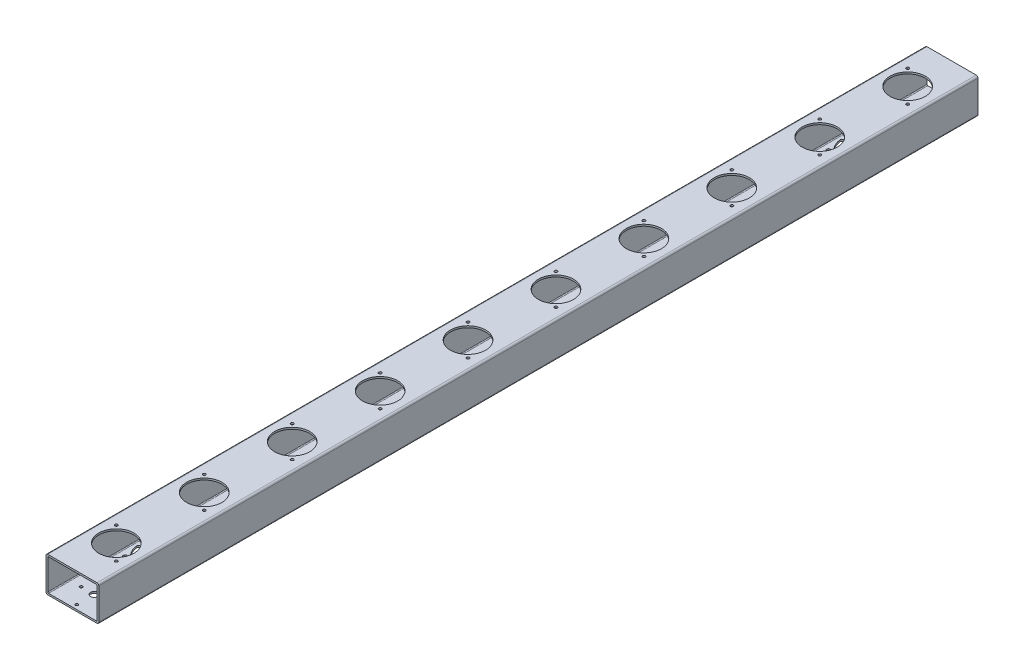
from build123d import *

# Parameters (mm, degrees)
ESQUISSE1_W                      = 60
ESQUISSE1_H                      = 40
ESQUISSE1_W_2                    = 56
ESQUISSE1_H_2                    = 36
BOSS_EXTRU_1_DEPTH               = 1000
CONG_1_R                         = 1
CONG_2_R                         = 2
ENL_V_MAT_EXTRU_1_REACH          = 1004.597
ESQUISSE2_R                      = 20
ENL_V_MAT_EXTRU_2_REACH          = 1004.597
ESQUISSE3_R                      = 4.25
ENL_V_MAT_EXTRU_3_REACH          = 1004.597
ESQUISSE4_R                      = 1.6
ENL_V_MAT_EXTRU_4_REACH          = 1004.597
ESQUISSE6_R                      = 1.6
R_P_TITION_LIN_AIRE1_COUNT       = 3
R_P_TITION_LIN_AIRE1_PITCH       = 200
R_P_TITION_LIN_AIRE1_COL_COUNT   = 2
R_P_TITION_LIN_AIRE1_COL_PITCH   = 200
ENL_V_MAT_EXTRU_5_REACH          = 1004.597
ESQUISSE7_R                      = 1.6
R_P_TITION_LIN_AIRE2_COUNT       = 10
R_P_TITION_LIN_AIRE2_PITCH       = 100
ENL_V_MAT_EXTRU_6_REACH          = 1004.597
ESQUISSE9_R                      = 1.1
R_P_TITION_LIN_AIRE3_COUNT       = 10
R_P_TITION_LIN_AIRE3_PITCH       = 100
ENL_V_MAT_EXTRU_7_REACH          = 1004.597
ESQUISSE10_R                     = 2.1
R_P_TITION_LIN_AIRE4_COUNT       = 2
R_P_TITION_LIN_AIRE4_PITCH       = 800
ENL_V_MAT_EXTRU_8_REACH          = 1004.597
CONG_3_R                         = 2
R_P_TITION_LIN_AIRE5_COUNT       = 2
R_P_TITION_LIN_AIRE5_PITCH       = 800
CONG_3_OF_R_P_TITION_LIN_AIRE5_R = 2
ENL_V_MAT_EXTRU_9_REACH          = 1004.597
ESQUISSE12_R                     = 1.6
ENL_V_MAT_EXTRU_10_REACH         = 1004.597
ESQUISSE13_R                     = 1.9
ESQUISSE13_W                     = 26
ESQUISSE13_H                     = 14
ENL_V_MAT_EXTRU_11_REACH         = 1004.597
ESQUISSE14_R                     = 1.6
ENL_V_MAT_EXTRU_12_REACH         = 1004.597
ESQUISSE15_R                     = 2.5


with BuildPart() as part:
    # Esquisse1 → Boss.-Extru.1 (new body)
    with BuildSketch(Plane.XY):
        with Locations((30, 20)):
            Rectangle(ESQUISSE1_W, ESQUISSE1_H)
        with Locations((30, 20)):
            Rectangle(ESQUISSE1_W_2, ESQUISSE1_H_2, mode=Mode.SUBTRACT)
    extrude(amount=BOSS_EXTRU_1_DEPTH)

    # Congé1
    cong_1_edges = [part.edges().sort_by_distance(p)[0] for p in [
        (2, 38, 500),
        (2, 2, 500),
        (58, 2, 500),
        (58, 38, 500),
    ]]
    fillet(cong_1_edges, radius=CONG_1_R)

    # Congé2
    cong_2_edges = [part.edges().sort_by_distance(p)[0] for p in [
        (0, 40, 500),
        (60, 40, 500),
        (60, 0, 500),
        (0, 0, 500),
    ]]
    fillet(cong_2_edges, radius=CONG_2_R)

    # Esquisse2 → Enlèv. mat.-Extru.1 (cut, up to next)
    with BuildSketch(Plane(origin=(0, 40, 0), x_dir=(1, 0, 0), z_dir=(0, 1, 0)), mode=Mode.PRIVATE) as enl_v_mat_extru_1_sk1:
        with Locations(Location((30, -50, 0), (0, 0, 270))):
            Circle(ESQUISSE2_R)
    enl_v_mat_extru_1_tool1 = extrude(enl_v_mat_extru_1_sk1.sketch, amount=-ENL_V_MAT_EXTRU_1_REACH, mode=Mode.PRIVATE) & part.part
    # Esquisse2 → Enlèv. mat.-Extru.1 (cut, up to next)
    with BuildSketch(Plane(origin=(0, 40, 0), x_dir=(1, 0, 0), z_dir=(0, 1, 0)), mode=Mode.PRIVATE) as enl_v_mat_extru_1_sk2:
        with Locations(Location((30, -150, 0), (0, 0, 270))):
            Circle(ESQUISSE2_R)
    enl_v_mat_extru_1_tool2 = extrude(enl_v_mat_extru_1_sk2.sketch, amount=-ENL_V_MAT_EXTRU_1_REACH, mode=Mode.PRIVATE) & part.part
    # Esquisse2 → Enlèv. mat.-Extru.1 (cut, up to next)
    with BuildSketch(Plane(origin=(0, 40, 0), x_dir=(1, 0, 0), z_dir=(0, 1, 0)), mode=Mode.PRIVATE) as enl_v_mat_extru_1_sk3:
        with Locations(Location((30, -250, 0), (0, 0, 270))):
            Circle(ESQUISSE2_R)
    enl_v_mat_extru_1_tool3 = extrude(enl_v_mat_extru_1_sk3.sketch, amount=-ENL_V_MAT_EXTRU_1_REACH, mode=Mode.PRIVATE) & part.part
    # Esquisse2 → Enlèv. mat.-Extru.1 (cut, up to next)
    with BuildSketch(Plane(origin=(0, 40, 0), x_dir=(1, 0, 0), z_dir=(0, 1, 0)), mode=Mode.PRIVATE) as enl_v_mat_extru_1_sk4:
        with Locations(Location((30, -350, 0), (0, 0, 270))):
            Circle(ESQUISSE2_R)
    enl_v_mat_extru_1_tool4 = extrude(enl_v_mat_extru_1_sk4.sketch, amount=-ENL_V_MAT_EXTRU_1_REACH, mode=Mode.PRIVATE) & part.part
    # Esquisse2 → Enlèv. mat.-Extru.1 (cut, up to next)
    with BuildSketch(Plane(origin=(0, 40, 0), x_dir=(1, 0, 0), z_dir=(0, 1, 0)), mode=Mode.PRIVATE) as enl_v_mat_extru_1_sk5:
        with Locations(Location((30, -450, 0), (0, 0, 270))):
            Circle(ESQUISSE2_R)
    enl_v_mat_extru_1_tool5 = extrude(enl_v_mat_extru_1_sk5.sketch, amount=-ENL_V_MAT_EXTRU_1_REACH, mode=Mode.PRIVATE) & part.part
    # Esquisse2 → Enlèv. mat.-Extru.1 (cut, up to next)
    with BuildSketch(Plane(origin=(0, 40, 0), x_dir=(1, 0, 0), z_dir=(0, 1, 0)), mode=Mode.PRIVATE) as enl_v_mat_extru_1_sk6:
        with Locations(Location((30, -550, 0), (0, 0, 270))):
            Circle(ESQUISSE2_R)
    enl_v_mat_extru_1_tool6 = extrude(enl_v_mat_extru_1_sk6.sketch, amount=-ENL_V_MAT_EXTRU_1_REACH, mode=Mode.PRIVATE) & part.part
    # Esquisse2 → Enlèv. mat.-Extru.1 (cut, up to next)
    with BuildSketch(Plane(origin=(0, 40, 0), x_dir=(1, 0, 0), z_dir=(0, 1, 0)), mode=Mode.PRIVATE) as enl_v_mat_extru_1_sk7:
        with Locations(Location((30, -650, 0), (0, 0, 270))):
            Circle(ESQUISSE2_R)
    enl_v_mat_extru_1_tool7 = extrude(enl_v_mat_extru_1_sk7.sketch, amount=-ENL_V_MAT_EXTRU_1_REACH, mode=Mode.PRIVATE) & part.part
    # Esquisse2 → Enlèv. mat.-Extru.1 (cut, up to next)
    with BuildSketch(Plane(origin=(0, 40, 0), x_dir=(1, 0, 0), z_dir=(0, 1, 0)), mode=Mode.PRIVATE) as enl_v_mat_extru_1_sk8:
        with Locations(Location((30, -750, 0), (0, 0, 270))):
            Circle(ESQUISSE2_R)
    enl_v_mat_extru_1_tool8 = extrude(enl_v_mat_extru_1_sk8.sketch, amount=-ENL_V_MAT_EXTRU_1_REACH, mode=Mode.PRIVATE) & part.part
    # Esquisse2 → Enlèv. mat.-Extru.1 (cut, up to next)
    with BuildSketch(Plane(origin=(0, 40, 0), x_dir=(1, 0, 0), z_dir=(0, 1, 0)), mode=Mode.PRIVATE) as enl_v_mat_extru_1_sk9:
        with Locations(Location((30, -850, 0), (0, 0, 270))):
            Circle(ESQUISSE2_R)
    enl_v_mat_extru_1_tool9 = extrude(enl_v_mat_extru_1_sk9.sketch, amount=-ENL_V_MAT_EXTRU_1_REACH, mode=Mode.PRIVATE) & part.part
    # Esquisse2 → Enlèv. mat.-Extru.1 (cut, up to next)
    with BuildSketch(Plane(origin=(0, 40, 0), x_dir=(1, 0, 0), z_dir=(0, 1, 0)), mode=Mode.PRIVATE) as enl_v_mat_extru_1_sk10:
        with Locations(Location((30, -950, 0), (0, 0, 270))):
            Circle(ESQUISSE2_R)
    enl_v_mat_extru_1_tool10 = extrude(enl_v_mat_extru_1_sk10.sketch, amount=-ENL_V_MAT_EXTRU_1_REACH, mode=Mode.PRIVATE) & part.part
    add(enl_v_mat_extru_1_tool1.solids().sort_by_distance((30, 40, 50))[0], mode=Mode.SUBTRACT)
    add(enl_v_mat_extru_1_tool2.solids().sort_by_distance((30, 40, 150))[0], mode=Mode.SUBTRACT)
    add(enl_v_mat_extru_1_tool3.solids().sort_by_distance((30, 40, 250))[0], mode=Mode.SUBTRACT)
    add(enl_v_mat_extru_1_tool4.solids().sort_by_distance((30, 40, 350))[0], mode=Mode.SUBTRACT)
    add(enl_v_mat_extru_1_tool5.solids().sort_by_distance((30, 40, 450))[0], mode=Mode.SUBTRACT)
    add(enl_v_mat_extru_1_tool6.solids().sort_by_distance((30, 40, 550))[0], mode=Mode.SUBTRACT)
    add(enl_v_mat_extru_1_tool7.solids().sort_by_distance((30, 40, 650))[0], mode=Mode.SUBTRACT)
    add(enl_v_mat_extru_1_tool8.solids().sort_by_distance((30, 40, 750))[0], mode=Mode.SUBTRACT)
    add(enl_v_mat_extru_1_tool9.solids().sort_by_distance((30, 40, 850))[0], mode=Mode.SUBTRACT)
    add(enl_v_mat_extru_1_tool10.solids().sort_by_distance((30, 40, 950))[0], mode=Mode.SUBTRACT)

    # Esquisse3 → Enlèv. mat.-Extru.2 (cut, up to next)
    with BuildSketch(Plane.XZ, mode=Mode.PRIVATE) as enl_v_mat_extru_2_sk1:
        with Locations(Location((30, 975, 0), (0, 0, 270))):
            Circle(ESQUISSE3_R)
    enl_v_mat_extru_2_tool1 = extrude(enl_v_mat_extru_2_sk1.sketch, amount=-ENL_V_MAT_EXTRU_2_REACH, mode=Mode.PRIVATE) & part.part
    # Esquisse3 → Enlèv. mat.-Extru.2 (cut, up to next)
    with BuildSketch(Plane.XZ, mode=Mode.PRIVATE) as enl_v_mat_extru_2_sk2:
        with Locations(Location((30, 25, 0), (0, 0, 270))):
            Circle(ESQUISSE3_R)
    enl_v_mat_extru_2_tool2 = extrude(enl_v_mat_extru_2_sk2.sketch, amount=-ENL_V_MAT_EXTRU_2_REACH, mode=Mode.PRIVATE) & part.part
    # Esquisse3 → Enlèv. mat.-Extru.2 (cut, up to next)
    with BuildSketch(Plane.XZ, mode=Mode.PRIVATE) as enl_v_mat_extru_2_sk3:
        with Locations(Location((30, 500, 0), (0, 0, 270))):
            Circle(ESQUISSE3_R)
    enl_v_mat_extru_2_tool3 = extrude(enl_v_mat_extru_2_sk3.sketch, amount=-ENL_V_MAT_EXTRU_2_REACH, mode=Mode.PRIVATE) & part.part
    add(enl_v_mat_extru_2_tool1.solids().sort_by_distance((30, 0, 975))[0], mode=Mode.SUBTRACT)
    add(enl_v_mat_extru_2_tool2.solids().sort_by_distance((30, 0, 25))[0], mode=Mode.SUBTRACT)
    add(enl_v_mat_extru_2_tool3.solids().sort_by_distance((30, 0, 500))[0], mode=Mode.SUBTRACT)

    # Esquisse4 → Enlèv. mat.-Extru.3 (cut, up to next)
    with BuildSketch(Plane(origin=(0, 40, 0), x_dir=(1, 0, 0), z_dir=(0, 1, 0)), mode=Mode.PRIVATE) as enl_v_mat_extru_3_sk1:
        with Locations(Location((12.32233047, -32.32233047, 0), (0, 0, 270))):
            Circle(ESQUISSE4_R)
    enl_v_mat_extru_3_tool1 = extrude(enl_v_mat_extru_3_sk1.sketch, amount=-ENL_V_MAT_EXTRU_3_REACH, mode=Mode.PRIVATE) & part.part
    # Esquisse4 → Enlèv. mat.-Extru.3 (cut, up to next)
    with BuildSketch(Plane(origin=(0, 40, 0), x_dir=(1, 0, 0), z_dir=(0, 1, 0)), mode=Mode.PRIVATE) as enl_v_mat_extru_3_sk2:
        with Locations(Location((47.67766953, -67.67766953, 0), (0, 0, 270))):
            Circle(ESQUISSE4_R)
    enl_v_mat_extru_3_tool2 = extrude(enl_v_mat_extru_3_sk2.sketch, amount=-ENL_V_MAT_EXTRU_3_REACH, mode=Mode.PRIVATE) & part.part
    enl_v_mat_extru_3_1 = enl_v_mat_extru_3_tool1.solids().sort_by_distance((12.32233, 40, 32.32233))[0]
    add(enl_v_mat_extru_3_1, mode=Mode.SUBTRACT)
    enl_v_mat_extru_3_2 = enl_v_mat_extru_3_tool2.solids().sort_by_distance((47.67767, 40, 67.67767))[0]
    add(enl_v_mat_extru_3_2, mode=Mode.SUBTRACT)
    enl_v_mat_extru_3 = enl_v_mat_extru_3_1 + enl_v_mat_extru_3_2  # Enlèv. mat.-Extru.3 as one shape, for the pattern or mirror that repeats it

    # Esquisse6 → Enlèv. mat.-Extru.4 (cut, up to next)
    with BuildSketch(Plane(origin=(0, 0, 0), x_dir=(-1, 0, 0), z_dir=(0, -1, 0)), mode=Mode.PRIVATE) as enl_v_mat_extru_4_sk1:
        with Locations(Location((-20, -400, 0), (0, 0, 90))):
            Circle(ESQUISSE6_R)
    enl_v_mat_extru_4_tool1 = extrude(enl_v_mat_extru_4_sk1.sketch, amount=-ENL_V_MAT_EXTRU_4_REACH, mode=Mode.PRIVATE) & part.part
    # Esquisse6 → Enlèv. mat.-Extru.4 (cut, up to next)
    with BuildSketch(Plane(origin=(0, 0, 0), x_dir=(-1, 0, 0), z_dir=(0, -1, 0)), mode=Mode.PRIVATE) as enl_v_mat_extru_4_sk2:
        with Locations(Location((-40, -400, 0), (0, 0, 90))):
            Circle(ESQUISSE6_R)
    enl_v_mat_extru_4_tool2 = extrude(enl_v_mat_extru_4_sk2.sketch, amount=-ENL_V_MAT_EXTRU_4_REACH, mode=Mode.PRIVATE) & part.part
    enl_v_mat_extru_4_1 = enl_v_mat_extru_4_tool1.solids().sort_by_distance((20, 0, 400))[0]
    add(enl_v_mat_extru_4_1, mode=Mode.SUBTRACT)
    enl_v_mat_extru_4_2 = enl_v_mat_extru_4_tool2.solids().sort_by_distance((40, 0, 400))[0]
    add(enl_v_mat_extru_4_2, mode=Mode.SUBTRACT)
    enl_v_mat_extru_4 = enl_v_mat_extru_4_1 + enl_v_mat_extru_4_2  # Enlèv. mat.-Extru.4 as one shape, for the pattern or mirror that repeats it

    # Répétition linéaire1: Enlèv. mat.-Extru.4 ×3
    with Locations(*[(0, 0, i * R_P_TITION_LIN_AIRE1_PITCH) for i in range(1, R_P_TITION_LIN_AIRE1_COUNT)]):
        add(enl_v_mat_extru_4, mode=Mode.SUBTRACT)

    # Répétition linéaire1 col: Enlèv. mat.-Extru.4 ×2
    with Locations(*[(0, 0, -i * R_P_TITION_LIN_AIRE1_COL_PITCH) for i in range(1, R_P_TITION_LIN_AIRE1_COL_COUNT)]):
        add(enl_v_mat_extru_4, mode=Mode.SUBTRACT)

    # Esquisse7 → Enlèv. mat.-Extru.5 (cut, up to next)
    with BuildSketch(Plane(origin=(0, 0, 0), x_dir=(-1, 0, 0), z_dir=(0, -1, 0)), mode=Mode.PRIVATE) as enl_v_mat_extru_5_sk1:
        with Locations(Location((-15, -25, 0), (0, 0, 90))):
            Circle(ESQUISSE7_R)
    enl_v_mat_extru_5_tool1 = extrude(enl_v_mat_extru_5_sk1.sketch, amount=-ENL_V_MAT_EXTRU_5_REACH, mode=Mode.PRIVATE) & part.part
    # Esquisse7 → Enlèv. mat.-Extru.5 (cut, up to next)
    with BuildSketch(Plane(origin=(0, 0, 0), x_dir=(-1, 0, 0), z_dir=(0, -1, 0)), mode=Mode.PRIVATE) as enl_v_mat_extru_5_sk2:
        with Locations(Location((-45, -25, 0), (0, 0, 90))):
            Circle(ESQUISSE7_R)
    enl_v_mat_extru_5_tool2 = extrude(enl_v_mat_extru_5_sk2.sketch, amount=-ENL_V_MAT_EXTRU_5_REACH, mode=Mode.PRIVATE) & part.part
    # Esquisse7 → Enlèv. mat.-Extru.5 (cut, up to next)
    with BuildSketch(Plane(origin=(0, 0, 0), x_dir=(-1, 0, 0), z_dir=(0, -1, 0)), mode=Mode.PRIVATE) as enl_v_mat_extru_5_sk3:
        with Locations(Location((-15, -500, 0), (0, 0, 90))):
            Circle(ESQUISSE7_R)
    enl_v_mat_extru_5_tool3 = extrude(enl_v_mat_extru_5_sk3.sketch, amount=-ENL_V_MAT_EXTRU_5_REACH, mode=Mode.PRIVATE) & part.part
    # Esquisse7 → Enlèv. mat.-Extru.5 (cut, up to next)
    with BuildSketch(Plane(origin=(0, 0, 0), x_dir=(-1, 0, 0), z_dir=(0, -1, 0)), mode=Mode.PRIVATE) as enl_v_mat_extru_5_sk4:
        with Locations(Location((-45, -500, 0), (0, 0, 90))):
            Circle(ESQUISSE7_R)
    enl_v_mat_extru_5_tool4 = extrude(enl_v_mat_extru_5_sk4.sketch, amount=-ENL_V_MAT_EXTRU_5_REACH, mode=Mode.PRIVATE) & part.part
    # Esquisse7 → Enlèv. mat.-Extru.5 (cut, up to next)
    with BuildSketch(Plane(origin=(0, 0, 0), x_dir=(-1, 0, 0), z_dir=(0, -1, 0)), mode=Mode.PRIVATE) as enl_v_mat_extru_5_sk5:
        with Locations(Location((-15, -975, 0), (0, 0, 90))):
            Circle(ESQUISSE7_R)
    enl_v_mat_extru_5_tool5 = extrude(enl_v_mat_extru_5_sk5.sketch, amount=-ENL_V_MAT_EXTRU_5_REACH, mode=Mode.PRIVATE) & part.part
    # Esquisse7 → Enlèv. mat.-Extru.5 (cut, up to next)
    with BuildSketch(Plane(origin=(0, 0, 0), x_dir=(-1, 0, 0), z_dir=(0, -1, 0)), mode=Mode.PRIVATE) as enl_v_mat_extru_5_sk6:
        with Locations(Location((-45, -975, 0), (0, 0, 90))):
            Circle(ESQUISSE7_R)
    enl_v_mat_extru_5_tool6 = extrude(enl_v_mat_extru_5_sk6.sketch, amount=-ENL_V_MAT_EXTRU_5_REACH, mode=Mode.PRIVATE) & part.part
    add(enl_v_mat_extru_5_tool1.solids().sort_by_distance((15, 0, 25))[0], mode=Mode.SUBTRACT)
    add(enl_v_mat_extru_5_tool2.solids().sort_by_distance((45, 0, 25))[0], mode=Mode.SUBTRACT)
    add(enl_v_mat_extru_5_tool3.solids().sort_by_distance((15, 0, 500))[0], mode=Mode.SUBTRACT)
    add(enl_v_mat_extru_5_tool4.solids().sort_by_distance((45, 0, 500))[0], mode=Mode.SUBTRACT)
    add(enl_v_mat_extru_5_tool5.solids().sort_by_distance((15, 0, 975))[0], mode=Mode.SUBTRACT)
    add(enl_v_mat_extru_5_tool6.solids().sort_by_distance((45, 0, 975))[0], mode=Mode.SUBTRACT)

    # Répétition linéaire2: Enlèv. mat.-Extru.3 ×10
    with Locations(*[(0, 0, i * R_P_TITION_LIN_AIRE2_PITCH) for i in range(1, R_P_TITION_LIN_AIRE2_COUNT)]):
        add(enl_v_mat_extru_3, mode=Mode.SUBTRACT)

    # Esquisse9 → Enlèv. mat.-Extru.6 (cut, up to next)
    with BuildSketch(Plane.XZ, mode=Mode.PRIVATE) as enl_v_mat_extru_6_sk1:
        with Locations(Location((22, 955.18, 0), (0, 0, 270))):
            Circle(ESQUISSE9_R)
    enl_v_mat_extru_6_tool1 = extrude(enl_v_mat_extru_6_sk1.sketch, amount=-ENL_V_MAT_EXTRU_6_REACH, mode=Mode.PRIVATE) & part.part
    # Esquisse9 → Enlèv. mat.-Extru.6 (cut, up to next)
    with BuildSketch(Plane.XZ, mode=Mode.PRIVATE) as enl_v_mat_extru_6_sk2:
        with Locations(Location((38, 955.18, 0), (0, 0, 270))):
            Circle(ESQUISSE9_R)
    enl_v_mat_extru_6_tool2 = extrude(enl_v_mat_extru_6_sk2.sketch, amount=-ENL_V_MAT_EXTRU_6_REACH, mode=Mode.PRIVATE) & part.part
    enl_v_mat_extru_6_1 = enl_v_mat_extru_6_tool1.solids().sort_by_distance((22, 0, 955.18))[0]
    add(enl_v_mat_extru_6_1, mode=Mode.SUBTRACT)
    enl_v_mat_extru_6_2 = enl_v_mat_extru_6_tool2.solids().sort_by_distance((38, 0, 955.18))[0]
    add(enl_v_mat_extru_6_2, mode=Mode.SUBTRACT)
    enl_v_mat_extru_6 = enl_v_mat_extru_6_1 + enl_v_mat_extru_6_2  # Enlèv. mat.-Extru.6 as one shape, for the pattern or mirror that repeats it

    # Répétition linéaire3: Enlèv. mat.-Extru.6 ×10
    with Locations(*[(0, 0, -i * R_P_TITION_LIN_AIRE3_PITCH) for i in range(1, R_P_TITION_LIN_AIRE3_COUNT)]):
        add(enl_v_mat_extru_6, mode=Mode.SUBTRACT)

    # Esquisse10 → Enlèv. mat.-Extru.7 (cut, up to next)
    with BuildSketch(Plane.XZ, mode=Mode.PRIVATE) as enl_v_mat_extru_7_sk1:
        with Locations(Location((10, 120, 0), (0, 0, 270))):
            Circle(ESQUISSE10_R)
    enl_v_mat_extru_7_tool1 = extrude(enl_v_mat_extru_7_sk1.sketch, amount=-ENL_V_MAT_EXTRU_7_REACH, mode=Mode.PRIVATE) & part.part
    # Esquisse10 → Enlèv. mat.-Extru.7 (cut, up to next)
    with BuildSketch(Plane.XZ, mode=Mode.PRIVATE) as enl_v_mat_extru_7_sk2:
        with Locations(Location((50, 120, 0), (0, 0, 270))):
            Circle(ESQUISSE10_R)
    enl_v_mat_extru_7_tool2 = extrude(enl_v_mat_extru_7_sk2.sketch, amount=-ENL_V_MAT_EXTRU_7_REACH, mode=Mode.PRIVATE) & part.part
    # Esquisse10 → Enlèv. mat.-Extru.7 (cut, up to next)
    with BuildSketch(Plane.XZ, mode=Mode.PRIVATE) as enl_v_mat_extru_7_sk3:
        with Locations(Location((50, 80, 0), (0, 0, 270))):
            Circle(ESQUISSE10_R)
    enl_v_mat_extru_7_tool3 = extrude(enl_v_mat_extru_7_sk3.sketch, amount=-ENL_V_MAT_EXTRU_7_REACH, mode=Mode.PRIVATE) & part.part
    # Esquisse10 → Enlèv. mat.-Extru.7 (cut, up to next)
    with BuildSketch(Plane.XZ, mode=Mode.PRIVATE) as enl_v_mat_extru_7_sk4:
        with Locations(Location((10, 80, 0), (0, 0, 270))):
            Circle(ESQUISSE10_R)
    enl_v_mat_extru_7_tool4 = extrude(enl_v_mat_extru_7_sk4.sketch, amount=-ENL_V_MAT_EXTRU_7_REACH, mode=Mode.PRIVATE) & part.part
    enl_v_mat_extru_7_1 = enl_v_mat_extru_7_tool1.solids().sort_by_distance((10, 0, 120))[0]
    add(enl_v_mat_extru_7_1, mode=Mode.SUBTRACT)
    enl_v_mat_extru_7_2 = enl_v_mat_extru_7_tool2.solids().sort_by_distance((50, 0, 120))[0]
    add(enl_v_mat_extru_7_2, mode=Mode.SUBTRACT)
    enl_v_mat_extru_7_3 = enl_v_mat_extru_7_tool3.solids().sort_by_distance((50, 0, 80))[0]
    add(enl_v_mat_extru_7_3, mode=Mode.SUBTRACT)
    enl_v_mat_extru_7_4 = enl_v_mat_extru_7_tool4.solids().sort_by_distance((10, 0, 80))[0]
    add(enl_v_mat_extru_7_4, mode=Mode.SUBTRACT)
    enl_v_mat_extru_7 = enl_v_mat_extru_7_1 + enl_v_mat_extru_7_2 + enl_v_mat_extru_7_3 + enl_v_mat_extru_7_4  # Enlèv. mat.-Extru.7 as one shape, for the pattern or mirror that repeats it

    # Répétition linéaire4: Enlèv. mat.-Extru.7 ×2
    with Locations(*[(0, 0, i * R_P_TITION_LIN_AIRE4_PITCH) for i in range(1, R_P_TITION_LIN_AIRE4_COUNT)]):
        add(enl_v_mat_extru_7, mode=Mode.SUBTRACT)

    # Esquisse11 → Enlèv. mat.-Extru.8 (cut, up to next)
    with BuildSketch(Plane.XZ, mode=Mode.PRIVATE) as enl_v_mat_extru_8_sk1:
        with BuildLine():
            ThreePointArc((41.123553404, 921.266559657), (18, 920.784609691), (6.020842383, 901))
            Line((6.020842383, 901), (12.027799244, 901))
            ThreePointArc((12.027799244, 901), (21, 915.588457268), (38.120074974, 916.064382416))
            Line((38.120074974, 916.064382416), (41.123553404, 921.266559657))
        make_face()
    enl_v_mat_extru_8_tool1 = extrude(enl_v_mat_extru_8_sk1.sketch, amount=-ENL_V_MAT_EXTRU_8_REACH, mode=Mode.PRIVATE) & part.part
    # Esquisse11 → Enlèv. mat.-Extru.8 (cut, up to next)
    with BuildSketch(Plane.XZ, mode=Mode.PRIVATE) as enl_v_mat_extru_8_sk2:
        with BuildLine():
            ThreePointArc((38.120074974, 883.935617584), (21, 884.411542732), (12.027799244, 899))
            Line((12.027799244, 899), (6.020842383, 899))
            ThreePointArc((6.020842383, 899), (18, 879.215390309), (41.123553404, 878.733440343))
            Line((41.123553404, 878.733440343), (38.120074974, 883.935617584))
        make_face()
    enl_v_mat_extru_8_tool2 = extrude(enl_v_mat_extru_8_sk2.sketch, amount=-ENL_V_MAT_EXTRU_8_REACH, mode=Mode.PRIVATE) & part.part
    # Esquisse11 → Enlèv. mat.-Extru.8 (cut, up to next)
    with BuildSketch(Plane.XZ, mode=Mode.PRIVATE) as enl_v_mat_extru_8_sk3:
        with BuildLine():
            Line((39.852125782, 884.935617584), (42.855604212, 879.733440343))
            ThreePointArc((42.855604212, 879.733440343), (54, 900), (42.855604212, 920.266559657))
            Line((42.855604212, 920.266559657), (39.852125782, 915.064382416))
            ThreePointArc((39.852125782, 915.064382416), (48, 900), (39.852125782, 884.935617584))
        make_face()
    enl_v_mat_extru_8_tool3 = extrude(enl_v_mat_extru_8_sk3.sketch, amount=-ENL_V_MAT_EXTRU_8_REACH, mode=Mode.PRIVATE) & part.part
    # Esquisse11 → Enlèv. mat.-Extru.8 (cut, up to next)
    with BuildSketch(Plane.XZ, mode=Mode.PRIVATE) as enl_v_mat_extru_8_sk4:
        with BuildLine():
            Line((20.050125629, 899), (14.031280577, 899))
            ThreePointArc((14.031280577, 899), (22, 886.143593539), (37.118334308, 885.670683314))
            Line((37.118334308, 885.670683314), (34.108911782, 890.88315603))
            ThreePointArc((34.108911782, 890.88315603), (25, 891.339745962), (20.050125629, 899))
        make_face()
    enl_v_mat_extru_8_tool4 = extrude(enl_v_mat_extru_8_sk4.sketch, amount=-ENL_V_MAT_EXTRU_8_REACH, mode=Mode.PRIVATE) & part.part
    # Esquisse11 → Enlèv. mat.-Extru.8 (cut, up to next)
    with BuildSketch(Plane.XZ, mode=Mode.PRIVATE) as enl_v_mat_extru_8_sk5:
        with BuildLine():
            ThreePointArc((35.840962589, 891.88315603), (40, 900), (35.840962589, 908.11684397))
            Line((35.840962589, 908.11684397), (38.850385115, 913.329316686))
            ThreePointArc((38.850385115, 913.329316686), (46, 900), (38.850385115, 886.670683314))
            Line((38.850385115, 886.670683314), (35.840962589, 891.88315603))
        make_face()
    enl_v_mat_extru_8_tool5 = extrude(enl_v_mat_extru_8_sk5.sketch, amount=-ENL_V_MAT_EXTRU_8_REACH, mode=Mode.PRIVATE) & part.part
    # Esquisse11 → Enlèv. mat.-Extru.8 (cut, up to next)
    with BuildSketch(Plane.XZ, mode=Mode.PRIVATE) as enl_v_mat_extru_8_sk6:
        with BuildLine():
            ThreePointArc((34.108911782, 909.11684397), (25, 908.660254038), (20.050125629, 901))
            Line((20.050125629, 901), (14.031280577, 901))
            ThreePointArc((14.031280577, 901), (22, 913.856406461), (37.118334308, 914.329316686))
            Line((37.118334308, 914.329316686), (34.108911782, 909.11684397))
        make_face()
    enl_v_mat_extru_8_tool6 = extrude(enl_v_mat_extru_8_sk6.sketch, amount=-ENL_V_MAT_EXTRU_8_REACH, mode=Mode.PRIVATE) & part.part
    enl_v_mat_extru_8_1 = enl_v_mat_extru_8_tool1.solids().sort_by_distance((20.790167, 0, 915.951899))[0]
    add(enl_v_mat_extru_8_1, mode=Mode.SUBTRACT)
    enl_v_mat_extru_8_2 = enl_v_mat_extru_8_tool2.solids().sort_by_distance((39.258372, 0, 881.124696))[0]
    add(enl_v_mat_extru_8_2, mode=Mode.SUBTRACT)
    enl_v_mat_extru_8_3 = enl_v_mat_extru_8_tool3.solids().sort_by_distance((53.570687, 0, 900))[0]
    add(enl_v_mat_extru_8_3, mode=Mode.SUBTRACT)
    enl_v_mat_extru_8_4 = enl_v_mat_extru_8_tool4.solids().sort_by_distance((24.369775, 0, 890.248165))[0]
    add(enl_v_mat_extru_8_4, mode=Mode.SUBTRACT)
    enl_v_mat_extru_8_5 = enl_v_mat_extru_8_tool5.solids().sort_by_distance((41.260449, 0, 900))[0]
    add(enl_v_mat_extru_8_5, mode=Mode.SUBTRACT)
    enl_v_mat_extru_8_6 = enl_v_mat_extru_8_tool6.solids().sort_by_distance((24.369775, 0, 909.751835))[0]
    add(enl_v_mat_extru_8_6, mode=Mode.SUBTRACT)
    enl_v_mat_extru_8 = enl_v_mat_extru_8_1 + enl_v_mat_extru_8_2 + enl_v_mat_extru_8_3 + enl_v_mat_extru_8_4 + enl_v_mat_extru_8_5 + enl_v_mat_extru_8_6  # Enlèv. mat.-Extru.8 as one shape, for the pattern or mirror that repeats it

    # Congé3
    cong_3_edges = [part.edges().sort_by_distance(p)[0] for p in [
        (14.031280577, 1, 899),
        (20.050125629, 1, 899),
        (34.108911782, 1, 890.88315603),
        (37.118334308, 1, 885.670683314),
        (35.840962589, 1, 891.88315603),
        (35.840962589, 1, 908.11684397),
        (38.850385115, 1, 913.329316686),
        (38.850385115, 1, 886.670683314),
        (12.027799244, 1, 899),
        (38.120074974, 1, 883.935617584),
        (41.123553404, 1, 878.733440343),
        (6.020842383, 1, 899),
        (39.852125782, 1, 884.935617584),
        (39.852125782, 1, 915.064382416),
        (42.855604212, 1, 920.266559657),
        (42.855604212, 1, 879.733440343),
        (34.108911782, 1, 909.11684397),
        (20.050125629, 1, 901),
        (14.031280577, 1, 901),
        (37.118334308, 1, 914.329316686),
        (38.120074974, 1, 916.064382416),
        (12.027799244, 1, 901),
        (6.020842383, 1, 901),
        (41.123553404, 1, 921.266559657),
    ]]
    fillet(cong_3_edges, radius=CONG_3_R)

    # Répétition linéaire5: Enlèv. mat.-Extru.8 ×2
    with Locations(*[(0, 0, -i * R_P_TITION_LIN_AIRE5_PITCH) for i in range(1, R_P_TITION_LIN_AIRE5_COUNT)]):
        add(enl_v_mat_extru_8, mode=Mode.SUBTRACT)

    # Congé3 of Répétition linéaire5
    cong_3_of_r_p_tition_lin_aire5_edges = [part.edges().sort_by_distance(p)[0] for p in [
        (14.031280577, 1, 99),
        (20.050125629, 1, 99),
        (34.108911782, 1, 90.88315603),
        (37.118334308, 1, 85.670683314),
        (35.840962589, 1, 91.88315603),
        (35.840962589, 1, 108.11684397),
        (38.850385115, 1, 113.329316686),
        (38.850385115, 1, 86.670683314),
        (12.027799244, 1, 99),
        (38.120074974, 1, 83.935617584),
        (41.123553404, 1, 78.733440343),
        (6.020842383, 1, 99),
        (39.852125782, 1, 84.935617584),
        (39.852125782, 1, 115.064382416),
        (42.855604212, 1, 120.266559657),
        (42.855604212, 1, 79.733440343),
        (34.108911782, 1, 109.11684397),
        (20.050125629, 1, 101),
        (14.031280577, 1, 101),
        (37.118334308, 1, 114.329316686),
        (38.120074974, 1, 116.064382416),
        (12.027799244, 1, 101),
        (6.020842383, 1, 101),
        (41.123553404, 1, 121.266559657),
    ]]
    fillet(cong_3_of_r_p_tition_lin_aire5_edges, radius=CONG_3_OF_R_P_TITION_LIN_AIRE5_R)

    # Esquisse12 → Enlèv. mat.-Extru.9 (cut, up to next)
    with BuildSketch(Plane.XZ, mode=Mode.PRIVATE) as enl_v_mat_extru_9_sk1:
        with Locations(Location((10, 740.18, 0), (0, 0, 270))):
            Circle(ESQUISSE12_R)
    enl_v_mat_extru_9_tool1 = extrude(enl_v_mat_extru_9_sk1.sketch, amount=-ENL_V_MAT_EXTRU_9_REACH, mode=Mode.PRIVATE) & part.part
    # Esquisse12 → Enlèv. mat.-Extru.9 (cut, up to next)
    with BuildSketch(Plane.XZ, mode=Mode.PRIVATE) as enl_v_mat_extru_9_sk2:
        with Locations(Location((50, 740.18, 0), (0, 0, 270))):
            Circle(ESQUISSE12_R)
    enl_v_mat_extru_9_tool2 = extrude(enl_v_mat_extru_9_sk2.sketch, amount=-ENL_V_MAT_EXTRU_9_REACH, mode=Mode.PRIVATE) & part.part
    # Esquisse12 → Enlèv. mat.-Extru.9 (cut, up to next)
    with BuildSketch(Plane.XZ, mode=Mode.PRIVATE) as enl_v_mat_extru_9_sk3:
        with Locations(Location((50, 670.18, 0), (0, 0, 270))):
            Circle(ESQUISSE12_R)
    enl_v_mat_extru_9_tool3 = extrude(enl_v_mat_extru_9_sk3.sketch, amount=-ENL_V_MAT_EXTRU_9_REACH, mode=Mode.PRIVATE) & part.part
    # Esquisse12 → Enlèv. mat.-Extru.9 (cut, up to next)
    with BuildSketch(Plane.XZ, mode=Mode.PRIVATE) as enl_v_mat_extru_9_sk4:
        with Locations(Location((10, 670.18, 0), (0, 0, 270))):
            Circle(ESQUISSE12_R)
    enl_v_mat_extru_9_tool4 = extrude(enl_v_mat_extru_9_sk4.sketch, amount=-ENL_V_MAT_EXTRU_9_REACH, mode=Mode.PRIVATE) & part.part
    add(enl_v_mat_extru_9_tool1.solids().sort_by_distance((10, 0, 740.18))[0], mode=Mode.SUBTRACT)
    add(enl_v_mat_extru_9_tool2.solids().sort_by_distance((50, 0, 740.18))[0], mode=Mode.SUBTRACT)
    add(enl_v_mat_extru_9_tool3.solids().sort_by_distance((50, 0, 670.18))[0], mode=Mode.SUBTRACT)
    add(enl_v_mat_extru_9_tool4.solids().sort_by_distance((10, 0, 670.18))[0], mode=Mode.SUBTRACT)

    # Esquisse13 → Enlèv. mat.-Extru.10 (cut, up to next)
    with BuildSketch(Plane.XZ, mode=Mode.PRIVATE) as enl_v_mat_extru_10_sk1:
        with Locations(Location((17, 705.18, 0), (0, 0, 270))):
            Circle(ESQUISSE13_R)
    enl_v_mat_extru_10_tool1 = extrude(enl_v_mat_extru_10_sk1.sketch, amount=-ENL_V_MAT_EXTRU_10_REACH, mode=Mode.PRIVATE) & part.part
    # Esquisse13 → Enlèv. mat.-Extru.10 (cut, up to next)
    with BuildSketch(Plane.XZ, mode=Mode.PRIVATE) as enl_v_mat_extru_10_sk2:
        with Locations(Location((30, 705.18, 0), (0, 0, 270))):
            Circle(ESQUISSE13_R)
    enl_v_mat_extru_10_tool2 = extrude(enl_v_mat_extru_10_sk2.sketch, amount=-ENL_V_MAT_EXTRU_10_REACH, mode=Mode.PRIVATE) & part.part
    # Esquisse13 → Enlèv. mat.-Extru.10 (cut, up to next)
    with BuildSketch(Plane.XZ, mode=Mode.PRIVATE) as enl_v_mat_extru_10_sk3:
        with Locations(Location((43, 705.18, 0), (0, 0, 270))):
            Circle(ESQUISSE13_R)
    enl_v_mat_extru_10_tool3 = extrude(enl_v_mat_extru_10_sk3.sketch, amount=-ENL_V_MAT_EXTRU_10_REACH, mode=Mode.PRIVATE) & part.part
    # Esquisse13 → Enlèv. mat.-Extru.10 (cut, up to next)
    with BuildSketch(Plane.XZ, mode=Mode.PRIVATE) as enl_v_mat_extru_10_sk4:
        with Locations((30, 722.18)):
            Rectangle(ESQUISSE13_W, ESQUISSE13_H)
    enl_v_mat_extru_10_tool4 = extrude(enl_v_mat_extru_10_sk4.sketch, amount=-ENL_V_MAT_EXTRU_10_REACH, mode=Mode.PRIVATE) & part.part
    add(enl_v_mat_extru_10_tool1.solids().sort_by_distance((17, 0, 705.18))[0], mode=Mode.SUBTRACT)
    add(enl_v_mat_extru_10_tool2.solids().sort_by_distance((30, 0, 705.18))[0], mode=Mode.SUBTRACT)
    add(enl_v_mat_extru_10_tool3.solids().sort_by_distance((43, 0, 705.18))[0], mode=Mode.SUBTRACT)
    add(enl_v_mat_extru_10_tool4.solids().sort_by_distance((30, 0, 722.18))[0], mode=Mode.SUBTRACT)

    # Esquisse14 → Enlèv. mat.-Extru.11 (cut, up to next)
    with BuildSketch(Plane.XZ, mode=Mode.PRIVATE) as enl_v_mat_extru_11_sk1:
        with Locations(Location((30, 5, 0), (0, 0, 270))):
            Circle(ESQUISSE14_R)
    enl_v_mat_extru_11_tool1 = extrude(enl_v_mat_extru_11_sk1.sketch, amount=-ENL_V_MAT_EXTRU_11_REACH, mode=Mode.PRIVATE) & part.part
    # Esquisse14 → Enlèv. mat.-Extru.11 (cut, up to next)
    with BuildSketch(Plane.XZ, mode=Mode.PRIVATE) as enl_v_mat_extru_11_sk2:
        with Locations(Location((30, 995, 0), (0, 0, 270))):
            Circle(ESQUISSE14_R)
    enl_v_mat_extru_11_tool2 = extrude(enl_v_mat_extru_11_sk2.sketch, amount=-ENL_V_MAT_EXTRU_11_REACH, mode=Mode.PRIVATE) & part.part
    add(enl_v_mat_extru_11_tool1.solids().sort_by_distance((30, 0, 5))[0], mode=Mode.SUBTRACT)
    add(enl_v_mat_extru_11_tool2.solids().sort_by_distance((30, 0, 995))[0], mode=Mode.SUBTRACT)

    # Esquisse15 → Enlèv. mat.-Extru.12 (cut, up to next)
    with BuildSketch(Plane.XZ, mode=Mode.PRIVATE) as enl_v_mat_extru_12_sk1:
        with Locations(Location((30, 425, 0), (0, 0, 270))):
            Circle(ESQUISSE15_R)
    enl_v_mat_extru_12_tool1 = extrude(enl_v_mat_extru_12_sk1.sketch, amount=-ENL_V_MAT_EXTRU_12_REACH, mode=Mode.PRIVATE) & part.part
    add(enl_v_mat_extru_12_tool1.solids().sort_by_distance((30, 0, 425))[0], mode=Mode.SUBTRACT)


solid = part.part
